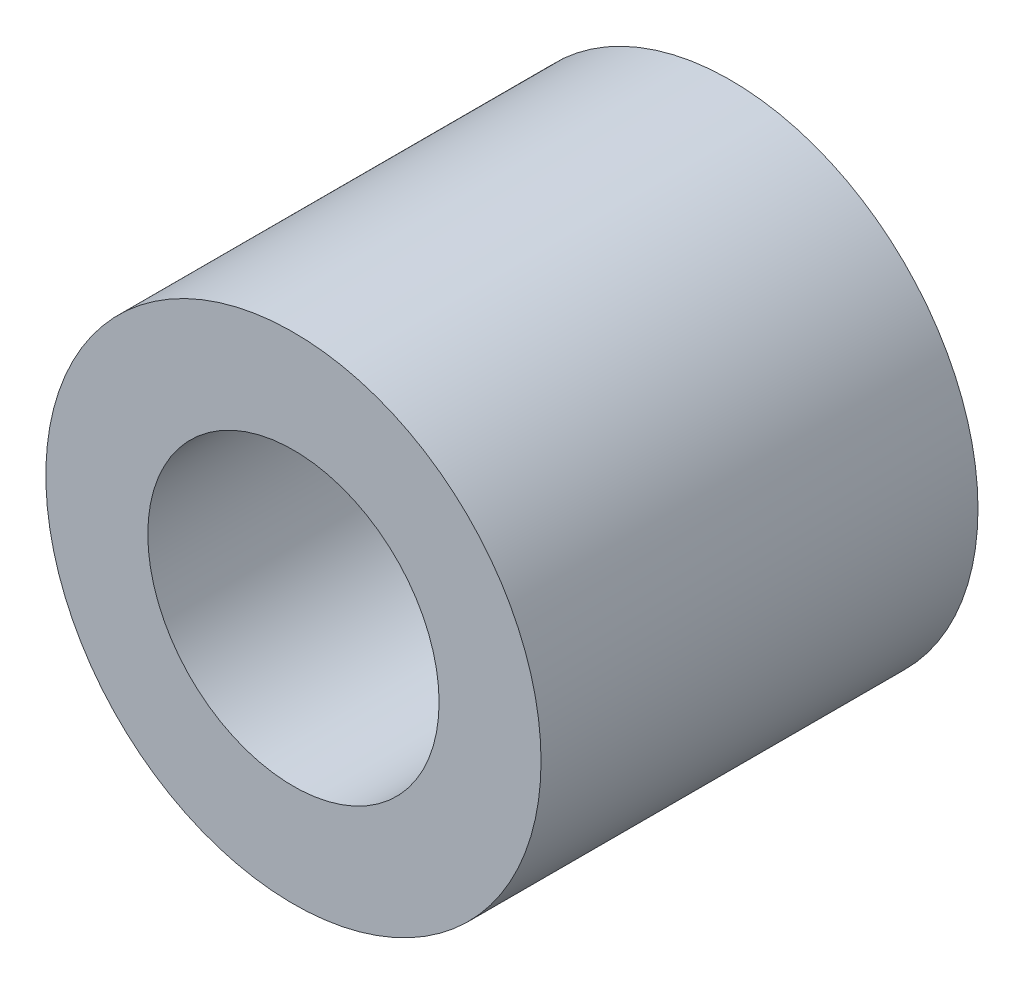
from build123d import *

# Parameters (mm, degrees)
SKETCH1_R           = 8.5
SKETCH1_R_2         = 5
BOSS_EXTRUDE1_DEPTH = 7.5


with BuildPart() as part:
    # Sketch1 → Boss-Extrude1 (new, symmetric)
    with BuildSketch(Plane.XY):
        Circle(SKETCH1_R)
        Circle(SKETCH1_R_2, mode=Mode.SUBTRACT)
    extrude(amount=BOSS_EXTRUDE1_DEPTH, both=True)


solid = part.part
